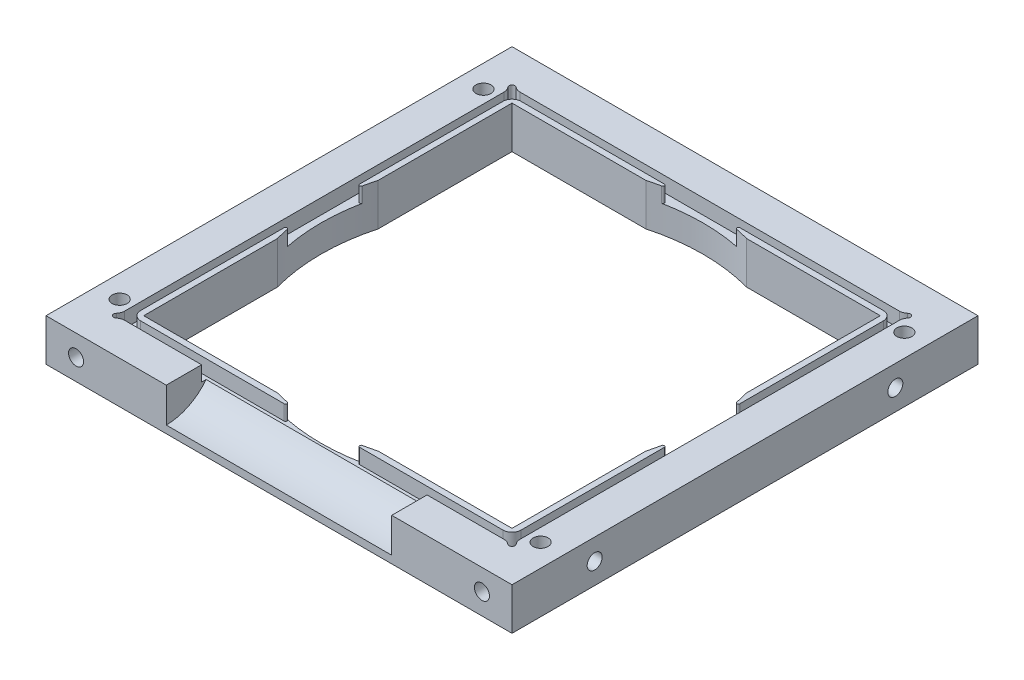
from build123d import *

# Parameters (mm, degrees)
SKETCH1_W           = 155
SKETCH1_H           = 155
BOSS_EXTRUDE1_DEPTH = 14
SKETCH2_W           = 131.5
SKETCH2_H           = 131.5
SKETCH2_W_2         = 126.5
SKETCH2_H_2         = 126.5
CUT_EXTRUDE1_DEPTH  = 5
SKETCH3_W           = 122.5
SKETCH3_H           = 122.5
CUT_EXTRUDE2_DEPTH  = 111.492081164
SKETCH6_R           = 2.5
CUT_EXTRUDE5_DEPTH  = 11
SKETCH7_R           = 2.5
CUT_EXTRUDE6_DEPTH  = 111.492081164
SKETCH8_W           = 75
SKETCH8_H           = 14
CUT_EXTRUDE7_DEPTH  = 13.25
CUT_EXTRUDE8_START  = -5
SKETCH9_R           = 1
CUT_EXTRUDE8_DEPTH  = 5
FILLET1_R           = 3
SKETCH10_R          = 2.5
CUT_EXTRUDE9_DEPTH  = 10
BOSS_EXTRUDE2_DEPTH = 75
SKETCH11_R          = 63.5
CUT_EXTRUDE10_DEPTH = 111.492081234
FILLET2_R           = 0.5


with BuildPart() as part:
    # Sketch1 → Boss-Extrude1 (new body)
    with BuildSketch(Plane(origin=(0, 0, 0), x_dir=(1, 0, 0), z_dir=(0, 1, 0))):
        Rectangle(SKETCH1_W, SKETCH1_H)
    extrude(amount=BOSS_EXTRUDE1_DEPTH)

    # Sketch2 → Cut-Extrude1 (cut)
    with BuildSketch(Plane(origin=(0, 14, 0), x_dir=(1, 0, 0), z_dir=(0, 1, 0))):
        Rectangle(SKETCH2_W, SKETCH2_H)
        Rectangle(SKETCH2_W_2, SKETCH2_H_2, mode=Mode.SUBTRACT)
    extrude(amount=-CUT_EXTRUDE1_DEPTH, mode=Mode.SUBTRACT)

    # Sketch3 → Cut-Extrude2 (cut, through all)
    with BuildSketch(Plane(origin=(0, 14, 0), x_dir=(1, 0, 0), z_dir=(0, 1, 0))):
        Rectangle(SKETCH3_W, SKETCH3_H)
    extrude(amount=-CUT_EXTRUDE2_DEPTH, mode=Mode.SUBTRACT)

    # Sketch6 → Cut-Extrude5 (cut)
    with BuildSketch(Plane.XY.offset(77.5)):
        with Locations((67.5, 7)):
            Circle(SKETCH6_R)
        with Locations((-67.5, 7)):
            Circle(SKETCH6_R)
    extrude(amount=-CUT_EXTRUDE5_DEPTH, mode=Mode.SUBTRACT)

    # Sketch7 → Cut-Extrude6 (cut, through all)
    with BuildSketch(Plane.XZ):
        with Locations(Location((70, -60.5, 0), (0, 0, 270))):
            Circle(SKETCH7_R)
        with Locations(Location((70, 60.5, 0), (0, 0, 270))):
            Circle(SKETCH7_R)
        with Locations(Location((-70, 60.5, 0), (0, 0, 270))):
            Circle(SKETCH7_R)
        with Locations(Location((-70, -60.5, 0), (0, 0, 270))):
            Circle(SKETCH7_R)
    extrude(amount=-CUT_EXTRUDE6_DEPTH, mode=Mode.SUBTRACT)

    # Sketch8 → Cut-Extrude7 (cut)
    with BuildSketch(Plane.XY.offset(77.5)):
        with Locations((0, 7)):
            Rectangle(SKETCH8_W, SKETCH8_H)
    extrude(amount=-CUT_EXTRUDE7_DEPTH, mode=Mode.SUBTRACT)

    # Sketch9 → Cut-Extrude8 (cut)
    with BuildSketch(Plane(origin=(0, 14, 0), x_dir=(1, 0, 0), z_dir=(0, 1, 0)).offset(CUT_EXTRUDE8_START)):
        with Locations((-65.75, 65.75)):
            Circle(SKETCH9_R)
        with Locations((65.75, 65.75)):
            Circle(SKETCH9_R)
        with Locations((65.75, -65.75)):
            Circle(SKETCH9_R)
        with Locations((-65.75, -65.75)):
            Circle(SKETCH9_R)
    extrude(amount=CUT_EXTRUDE8_DEPTH, mode=Mode.SUBTRACT)

    # Fillet1
    fillet1_edges = [part.edges().sort_by_distance(p)[0] for p in [
        (-64.75, 11.5, 65.75),
        (-65.75, 11.5, 64.75),
        (64.75, 11.5, 65.75),
        (65.75, 11.5, 64.75),
        (64.75, 11.5, -65.75),
        (65.75, 11.5, -64.75),
        (-65.75, 11.5, -64.75),
        (-64.75, 11.5, -65.75),
        (-63.25, 11.5, -63.25),
        (63.25, 11.5, -63.25),
        (63.25, 11.5, 63.25),
        (-63.25, 11.5, 63.25),
    ]]
    fillet(fillet1_edges, radius=FILLET1_R)

    # Sketch10 → Cut-Extrude9 (cut)
    with BuildSketch(Plane(origin=(77.5, 0, 0), x_dir=(0, 0, -1), z_dir=(1, 0, 0))):
        with Locations((50, 7)):
            Circle(SKETCH10_R)
        with Locations((-50, 7)):
            Circle(SKETCH10_R)
    extrude(amount=-CUT_EXTRUDE9_DEPTH, mode=Mode.SUBTRACT)

    # Sketch12 → Boss-Extrude2 (add)
    with BuildSketch(Plane.ZY.offset(-37.5)):
        with BuildLine():
            Line((77.5, 2.5), (77.5, 0))
            Line((77.5, 0), (64.25, 0))
            Line((64.25, 0), (64.25, 9))
            ThreePointArc((64.25, 9), (70.120763928, 4.212518777), (77.5, 2.5))
        make_face()
    extrude(amount=BOSS_EXTRUDE2_DEPTH)

    # Sketch11 → Cut-Extrude10 (cut, through all)
    with BuildSketch(Plane(origin=(0, 14, 0), x_dir=(1, 0, 0), z_dir=(0, 1, 0))):
        Circle(SKETCH11_R)
    extrude(amount=-CUT_EXTRUDE10_DEPTH, mode=Mode.SUBTRACT)

    # Fillet2
    fillet2_edges = [part.edges().sort_by_distance(p)[0] for p in [
        (-63.25, 11.5, 5.629165125),
        (-63.25, 11.5, -5.629165125),
        (-5.629165125, 11.5, -63.25),
        (5.629165125, 11.5, -63.25),
        (63.25, 11.5, -5.629165125),
        (63.25, 11.5, 5.629165125),
        (5.629165125, 11.5, 63.25),
        (-5.629165125, 11.5, 63.25),
    ]]
    fillet(fillet2_edges, radius=FILLET2_R)


solid = part.part
